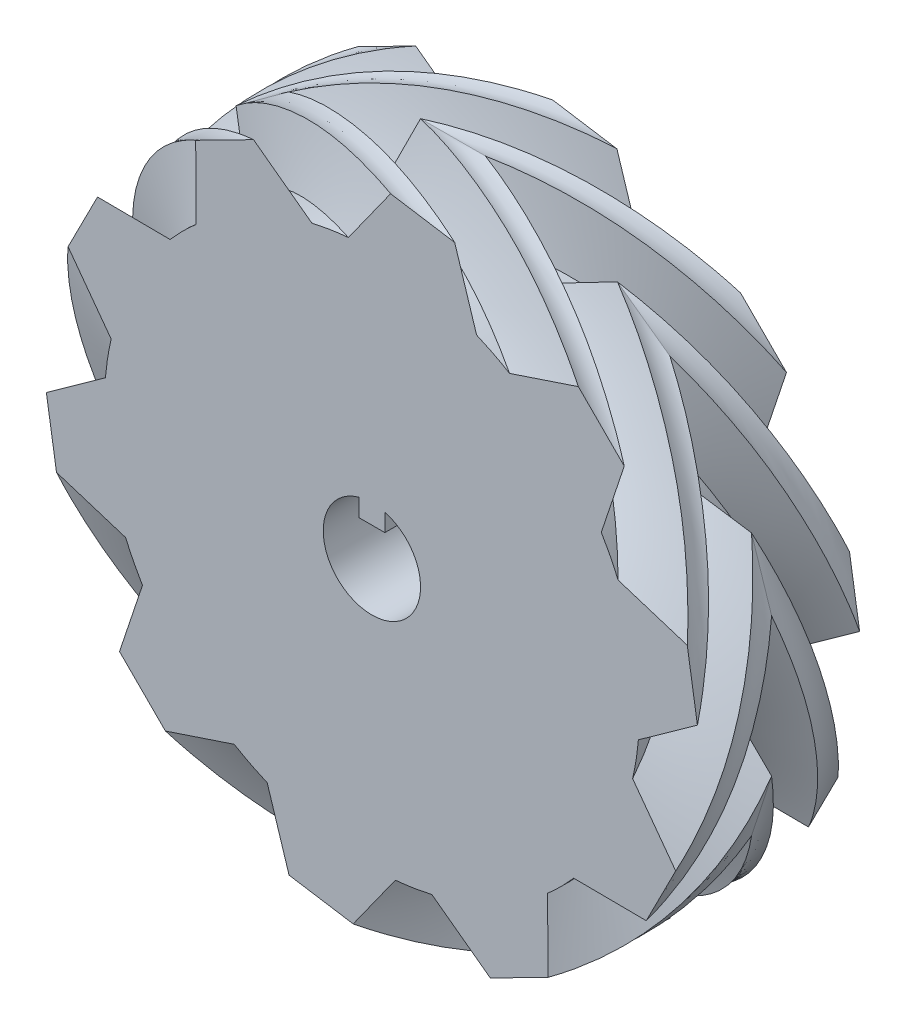
from build123d import *

# Parameters (mm, degrees)
SWEEP2_PITCH       = 10
SWEEP2_HEIGHT      = 1.25
SWEEP2_RADIUS      = 2.5
CUT_EXTRUDE1_DEPTH = 8.533251797


with BuildPart() as part:
    # Sweep2: sweep along a helix
    with BuildLine() as sweep2_path:
        Helix(SWEEP2_PITCH, SWEEP2_HEIGHT, SWEEP2_RADIUS, center=(0, 0, 0), direction=(0, 0, -1))
    # Sketch1 → Sweep2 (sweep)
    with BuildSketch(Plane.XY):
        with BuildLine():
            Line((-0.5, 5), (0.5, 5))
            Line((0.5, 5), (1, 4))
            ThreePointArc((1, 4), (1.274109708, 3.921306473), (1.542124015, 3.82385323))
            Line((1.542124015, 3.82385323), (2.534417764, 4.338977598))
            Line((2.534417764, 4.338977598), (3.343434759, 3.751192346))
            Line((3.343434759, 3.751192346), (3.160158004, 2.648282725))
            ThreePointArc((3.160158004, 2.648282725), (3.335662521, 2.42350068), (3.495209071, 2.187124494))
            Line((3.495209071, 2.187124494), (4.600774084, 2.02061323))
            Line((4.600774084, 2.02061323), (4.909791079, 1.069556714))
            Line((4.909791079, 1.069556714), (4.11324306, 0.285011461))
            ThreePointArc((4.11324306, 0.285011461), (4.123105626, 0), (4.11324306, -0.285011461))
            Line((4.11324306, -0.285011461), (4.909791079, -1.069556714))
            Line((4.909791079, -1.069556714), (4.600774084, -2.02061323))
            Line((4.600774084, -2.02061323), (3.495209071, -2.187124494))
            ThreePointArc((3.495209071, -2.187124494), (3.335662521, -2.42350068), (3.160158004, -2.648282725))
            Line((3.160158004, -2.648282725), (3.343434759, -3.751192346))
            Line((3.343434759, -3.751192346), (2.534417764, -4.338977598))
            Line((2.534417764, -4.338977598), (1.542124015, -3.82385323))
            ThreePointArc((1.542124015, -3.82385323), (1.274109708, -3.921306473), (1, -4))
            Line((1, -4), (0.5, -5))
            Line((0.5, -5), (-0.5, -5))
            Line((-0.5, -5), (-1, -4))
            ThreePointArc((-1, -4), (-1.274109708, -3.921306473), (-1.542124015, -3.82385323))
            Line((-1.542124015, -3.82385323), (-2.534417764, -4.338977598))
            Line((-2.534417764, -4.338977598), (-3.343434759, -3.751192346))
            Line((-3.343434759, -3.751192346), (-3.160158004, -2.648282725))
            ThreePointArc((-3.160158004, -2.648282725), (-3.335662521, -2.42350068), (-3.495209071, -2.187124494))
            Line((-3.495209071, -2.187124494), (-4.600774084, -2.02061323))
            Line((-4.600774084, -2.02061323), (-4.909791079, -1.069556714))
            Line((-4.909791079, -1.069556714), (-4.11324306, -0.285011461))
            ThreePointArc((-4.11324306, -0.285011461), (-4.123105626, 0), (-4.11324306, 0.285011461))
            Line((-4.11324306, 0.285011461), (-4.909791079, 1.069556714))
            Line((-4.909791079, 1.069556714), (-4.600774084, 2.02061323))
            Line((-4.600774084, 2.02061323), (-3.495209071, 2.187124494))
            ThreePointArc((-3.495209071, 2.187124494), (-3.335662521, 2.42350068), (-3.160158004, 2.648282725))
            Line((-3.160158004, 2.648282725), (-3.343434759, 3.751192346))
            Line((-3.343434759, 3.751192346), (-2.534417764, 4.338977598))
            Line((-2.534417764, 4.338977598), (-1.542124015, 3.82385323))
            ThreePointArc((-1.542124015, 3.82385323), (-1.274109708, 3.921306473), (-1, 4))
            Line((-1, 4), (-0.5, 5))
        make_face()
    sweep2 = sweep(path=sweep2_path.line, is_frenet=True)

    # Mirror1: Sweep2 across plane
    add(sweep2.mirror(Plane.XY))

    # Sketch4 → Cut-Extrude1 (cut, through all)
    with BuildSketch(Plane(origin=(0, 0, -1.25), x_dir=(-1, 0, 0), z_dir=(0, 0, -1))):
        with BuildLine():
            Line((-0.2, 0.45), (0.2, 0.45))
            Line((0.2, 0.45), (0.2, 0.722841615))
            ThreePointArc((0.2, 0.722841615), (0, -0.75), (-0.2, 0.722841615))
            Line((-0.2, 0.722841615), (-0.2, 0.45))
        make_face()
    extrude(amount=-CUT_EXTRUDE1_DEPTH, mode=Mode.SUBTRACT)


solid = part.part
